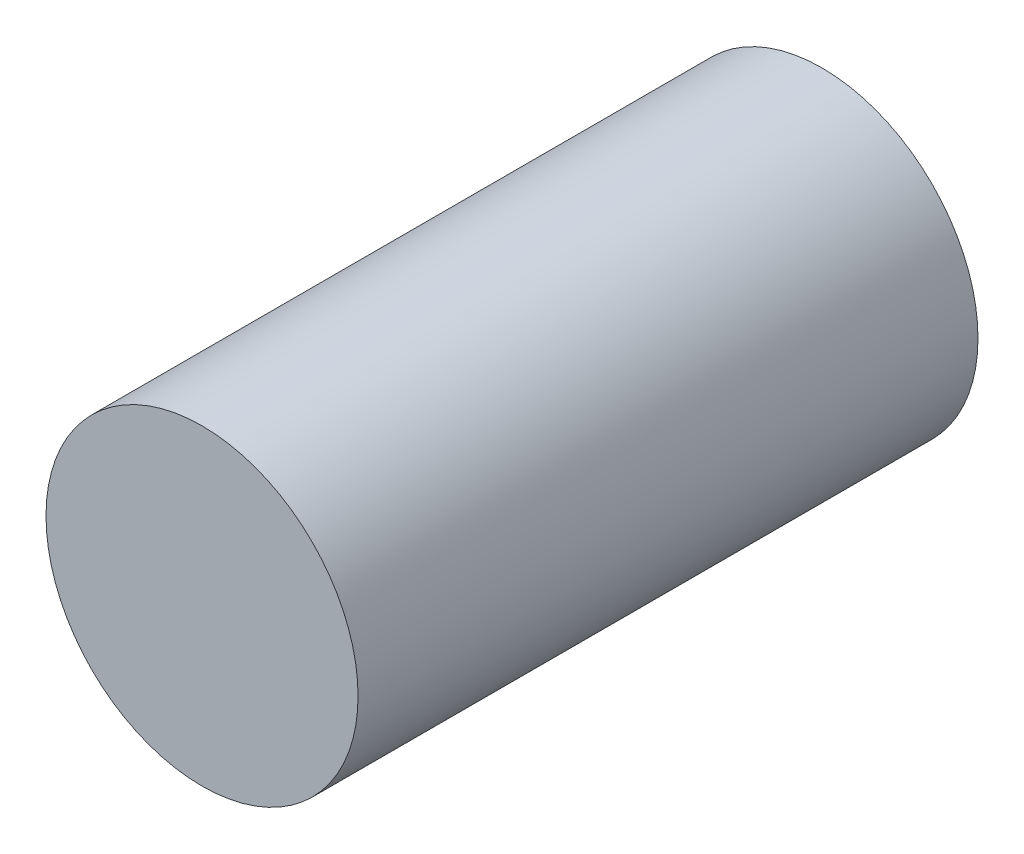
from build123d import *

# Parameters (mm, degrees)
SKETCH1_R           = 37.25
BOSS_EXTRUDE1_DEPTH = 148


with BuildPart() as part:
    # Sketch1 → Boss-Extrude1 (new body)
    with BuildSketch(Plane.XY):
        Circle(SKETCH1_R)
    extrude(amount=BOSS_EXTRUDE1_DEPTH)


solid = part.part
